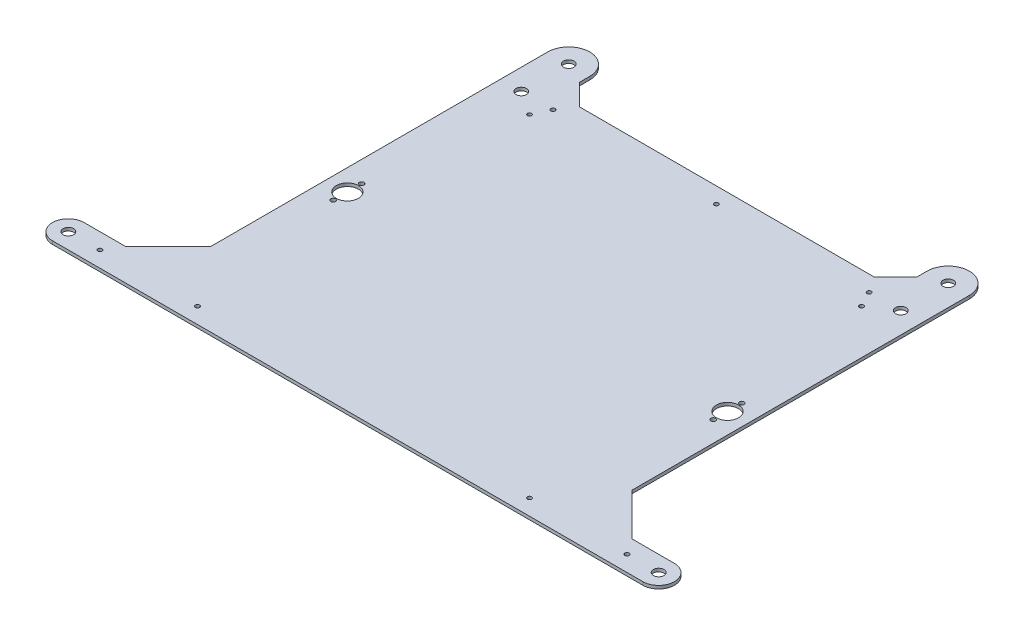
from build123d import *

# Parameters (mm, degrees)
SKETCH1_R           = 2
SKETCH1_R_2         = 5
SKETCH1_R_3         = 10.5
SKETCH1_R_4         = 2.25
BOSS_EXTRUDE1_DEPTH = 3
SKETCH2_R           = 5
BOSS_EXTRUDE2_DEPTH = 3
CHAMFER2_SIZE       = 20
CHAMFER3_SIZE       = 40


with BuildPart() as part:
    # Sketch1 → Boss-Extrude1 (new body)
    with BuildSketch(Plane(origin=(0, 0, 0), x_dir=(1, 0, 0), z_dir=(0, 1, 0))):
        with BuildLine():
            Line((-200.2851606, -142.500000035), (-280, -142.500000035))
            ThreePointArc((-280, -142.500000035), (-294.999999965, -157.5), (-280, -172.499999965))
            Line((-280, -172.499999965), (280, -172.499999965))
            ThreePointArc((280, -172.499999965), (294.999999965, -157.5), (280, -142.500000035))
            Line((280, -142.500000035), (199.7148394, -142.500000035))
            Line((199.7148394, -142.500000035), (199.7148394, 187.499999965))
            Line((199.7148394, 187.499999965), (-160.2851606, 187.499999965))
            Line((-160.2851606, 187.499999965), (-160.2851606, 217.499999965))
            ThreePointArc((-160.2851606, 217.499999965), (-180.2851606, 237.499999965), (-200.2851606, 217.499999965))
            Line((-200.2851606, 217.499999965), (-200.2851606, 187.499999965))
            Line((-200.2851606, 187.499999965), (-200.2851606, -142.500000035))
        make_face()
        with Locations(Location((-157.5, 157.5, 0), (0, 0, 270))):
            Circle(SKETCH1_R, mode=Mode.SUBTRACT)
        with Locations(Location((157.5, 157.5, 0), (0, 0, 270))):
            Circle(SKETCH1_R, mode=Mode.SUBTRACT)
        with Locations(Location((157.5, -157.5, 0), (0, 0, 270))):
            Circle(SKETCH1_R, mode=Mode.SUBTRACT)
        with Locations(Location((-157.5, -157.5, 0), (0, 0, 270))):
            Circle(SKETCH1_R, mode=Mode.SUBTRACT)
        with Locations(Location((-280, -157.5, 0), (0, 0, 270))):
            Circle(SKETCH1_R_2, mode=Mode.SUBTRACT)
        with Locations(Location((280, -157.5, 0), (0, 0, 270))):
            Circle(SKETCH1_R_2, mode=Mode.SUBTRACT)
        with Locations(Location((-250, -157.5, 0), (0, 0, 270))):
            Circle(SKETCH1_R, mode=Mode.SUBTRACT)
        with Locations(Location((250, -157.5, 0), (0, 0, 270))):
            Circle(SKETCH1_R, mode=Mode.SUBTRACT)
        with Locations(Location((-180.2851606, 172.499999965, 0), (0, 0, 270))):
            Circle(SKETCH1_R_2, mode=Mode.SUBTRACT)
        with Locations(Location((179.7148394, 172.499999965, 0), (0, 0, 270))):
            Circle(SKETCH1_R_2, mode=Mode.SUBTRACT)
        with Locations(Location((-150.2851606, 172.499999965, 0), (0, 0, 270))):
            Circle(SKETCH1_R, mode=Mode.SUBTRACT)
        with Locations(Location((4.7148394, 172.499999965, 0), (0, 0, 270))):
            Circle(SKETCH1_R, mode=Mode.SUBTRACT)
        with Locations(Location((149.7148394, 172.499999965, 0), (0, 0, 270))):
            Circle(SKETCH1_R, mode=Mode.SUBTRACT)
        with Locations(Location((-180.2851606, 7.499999983, 0), (0, 0, 270))):
            Circle(SKETCH1_R_3, mode=Mode.SUBTRACT)
        with Locations(Location((-180.2851606, 20.999999983, 0), (0, 0, 270))):
            Circle(SKETCH1_R_4, mode=Mode.SUBTRACT)
        with Locations(Location((-180.2851606, -6.000000017, 0), (0, 0, 270))):
            Circle(SKETCH1_R_4, mode=Mode.SUBTRACT)
        with Locations(Location((180.2851606, -6.000000017, 0), (0, 0, 90))):
            Circle(SKETCH1_R_4, mode=Mode.SUBTRACT)
        with Locations(Location((180.2851606, 20.999999983, 0), (0, 0, 90))):
            Circle(SKETCH1_R_4, mode=Mode.SUBTRACT)
        with Locations(Location((180.2851606, 7.499999983, 0), (0, 0, 90))):
            Circle(SKETCH1_R_3, mode=Mode.SUBTRACT)
        with Locations(Location((-180.2851606, 217.499999965, 0), (0, 0, 270))):
            Circle(SKETCH1_R_2, mode=Mode.SUBTRACT)
    extrude(amount=BOSS_EXTRUDE1_DEPTH)

    # Sketch2 → Boss-Extrude2 (add)
    with BuildSketch(Plane(origin=(0, 3, 0), x_dir=(1, 0, 0), z_dir=(0, 1, 0))):
        with BuildLine():
            Line((199.7148394, 187.499999965), (199.7148394, 217.499999965))
            ThreePointArc((199.7148394, 217.499999965), (179.7148394, 237.499999965), (159.7148394, 217.499999965))
            Line((159.7148394, 217.499999965), (159.7148394, 187.499999965))
            Line((159.7148394, 187.499999965), (199.7148394, 187.499999965))
        make_face()
        with Locations(Location((179.7148394, 217.499999965, 0), (0, 0, 270))):
            Circle(SKETCH2_R, mode=Mode.SUBTRACT)
    extrude(amount=-BOSS_EXTRUDE2_DEPTH)

    # Chamfer2
    chamfer2_edges = [part.edges().sort_by_distance(p)[0] for p in [
        (159.7148394, 1.5, -187.499999965),
        (-160.2851606, 1.5, -187.499999965),
    ]]
    chamfer(chamfer2_edges, length=CHAMFER2_SIZE)

    # Chamfer3
    chamfer3_edges = [part.edges().sort_by_distance(p)[0] for p in [
        (-200.2851606, 1.5, 142.500000035),
        (199.7148394, 1.5, 142.500000035),
    ]]
    chamfer(chamfer3_edges, length=CHAMFER3_SIZE)


solid = part.part
